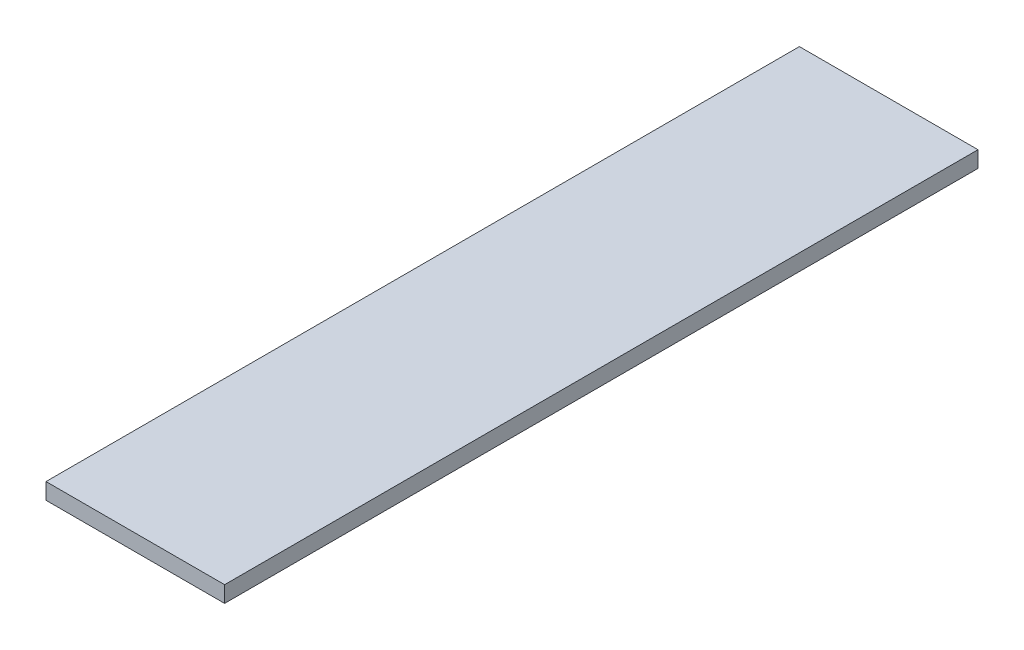
from build123d import *

# Parameters (mm, degrees)
SKETCH1_W           = 69.85
SKETCH1_H           = 6.35
BOSS_EXTRUDE1_DEPTH = 294.64


with BuildPart() as part:
    # Sketch1 → Boss-Extrude1 (new body)
    with BuildSketch(Plane.XY):
        with Locations((34.925, 3.175)):
            Rectangle(SKETCH1_W, SKETCH1_H)
    extrude(amount=BOSS_EXTRUDE1_DEPTH)


solid = part.part
